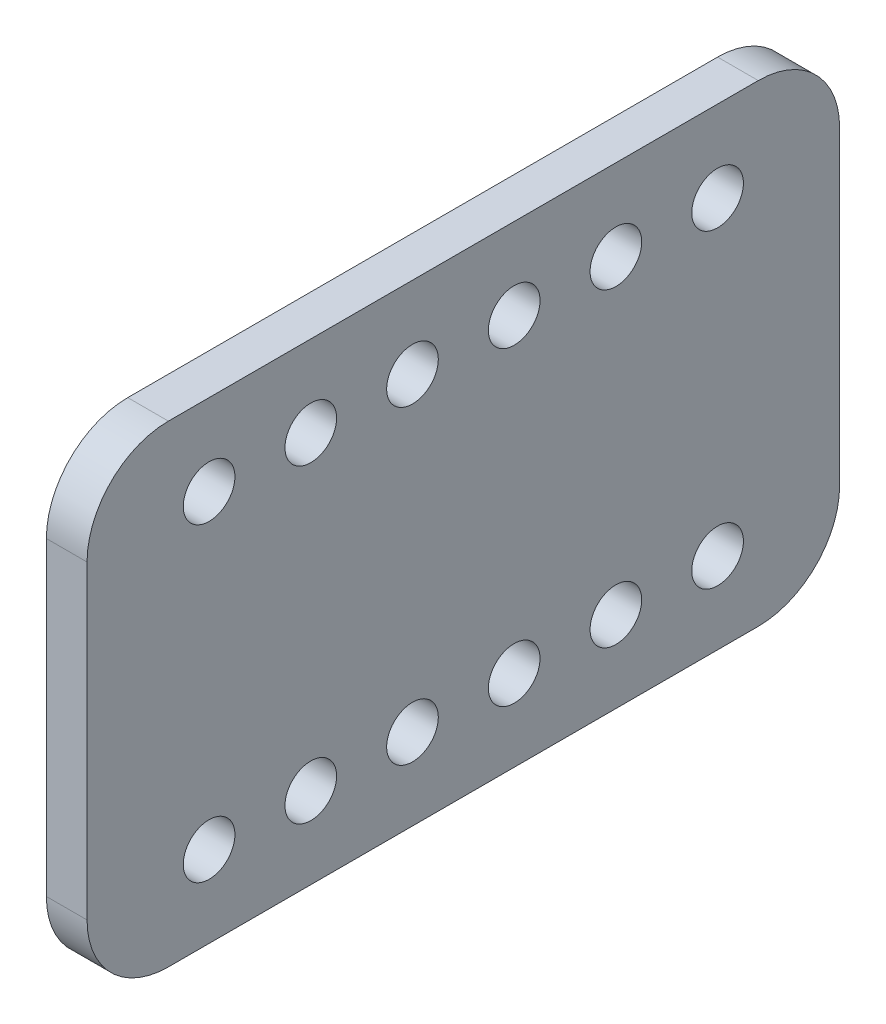
from build123d import *

# Parameters (mm, degrees)
SKETCH1_W           = 18.5
SKETCH1_H           = 11.62
SKETCH1_R           = 0.635
BOSS_EXTRUDE1_DEPTH = 1
FILLET1_R           = 2


with BuildPart() as part:
    # Sketch1 → Boss-Extrude1 (new body)
    with BuildSketch(Plane(origin=(0, 0, 0), x_dir=(0, 0, -1), z_dir=(1, 0, 0))):
        with Locations((9.25, 5.81)):
            Rectangle(SKETCH1_W, SKETCH1_H)
        with Locations((15.5, 9.62)):
            Circle(SKETCH1_R, mode=Mode.SUBTRACT)
        with Locations((13, 9.62)):
            Circle(SKETCH1_R, mode=Mode.SUBTRACT)
        with Locations((10.5, 9.62)):
            Circle(SKETCH1_R, mode=Mode.SUBTRACT)
        with Locations((8, 9.62)):
            Circle(SKETCH1_R, mode=Mode.SUBTRACT)
        with Locations((5.5, 9.62)):
            Circle(SKETCH1_R, mode=Mode.SUBTRACT)
        with Locations((3, 9.62)):
            Circle(SKETCH1_R, mode=Mode.SUBTRACT)
        with Locations((13, 2)):
            Circle(SKETCH1_R, mode=Mode.SUBTRACT)
        with Locations((10.5, 2)):
            Circle(SKETCH1_R, mode=Mode.SUBTRACT)
        with Locations((8, 2)):
            Circle(SKETCH1_R, mode=Mode.SUBTRACT)
        with Locations((5.5, 2)):
            Circle(SKETCH1_R, mode=Mode.SUBTRACT)
        with Locations((3, 2)):
            Circle(SKETCH1_R, mode=Mode.SUBTRACT)
        with Locations((15.5, 2)):
            Circle(SKETCH1_R, mode=Mode.SUBTRACT)
    extrude(amount=BOSS_EXTRUDE1_DEPTH)

    # Fillet1
    fillet1_edges = [part.edges().sort_by_distance(p)[0] for p in [
        (0.5, 11.62, 0),
        (0.5, 11.62, -18.5),
        (0.5, 0, -18.5),
        (0.5, 0, 0),
    ]]
    fillet(fillet1_edges, radius=FILLET1_R)


solid = part.part
